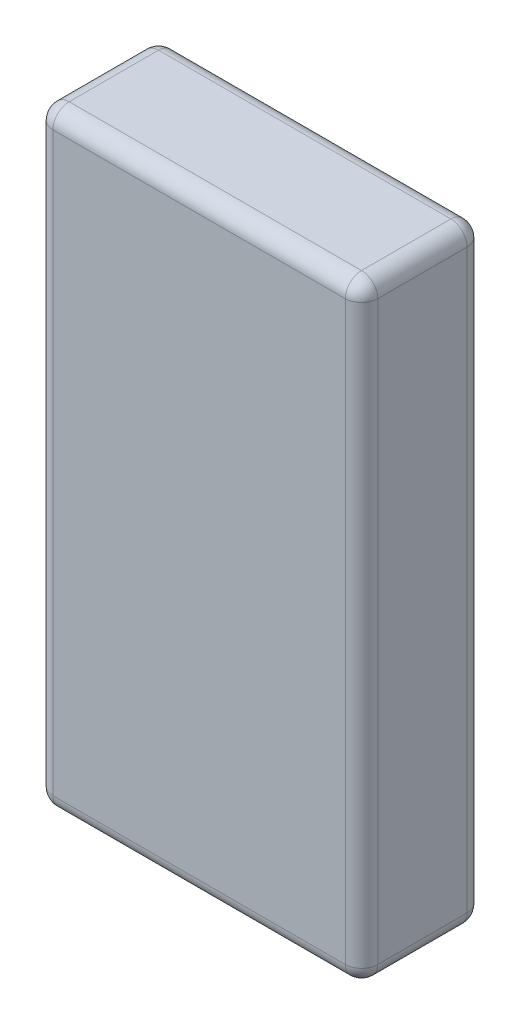
from build123d import *

# Parameters (mm, degrees)
SKETCH_1_W      = 40
SKETCH_1_H      = 15
EXTRUDE_1_DEPTH = 75
FILLET_1_R      = 2


with BuildPart() as part:
    # 草图1 → 凸台-拉伸1 (new body)
    with BuildSketch(Plane(origin=(0, 0, 0), x_dir=(1, 0, 0), z_dir=(0, 1, 0))):
        Rectangle(SKETCH_1_W, SKETCH_1_H)
    extrude(amount=EXTRUDE_1_DEPTH)

    # 圆角1
    fillet_1_edges = [part.edges().sort_by_distance(p)[0] for p in [
        (-20, 75, 0),
        (0, 75, 7.5),
        (20, 75, 0),
        (0, 0, 7.5),
        (-20, 0, 0),
        (0, 0, -7.5),
        (20, 0, 0),
        (20, 37.5, 7.5),
        (-20, 37.5, 7.5),
        (-20, 37.5, -7.5),
        (20, 37.5, -7.5),
        (0, 75, -7.5),
    ]]
    fillet(fillet_1_edges, radius=FILLET_1_R)


solid = part.part
